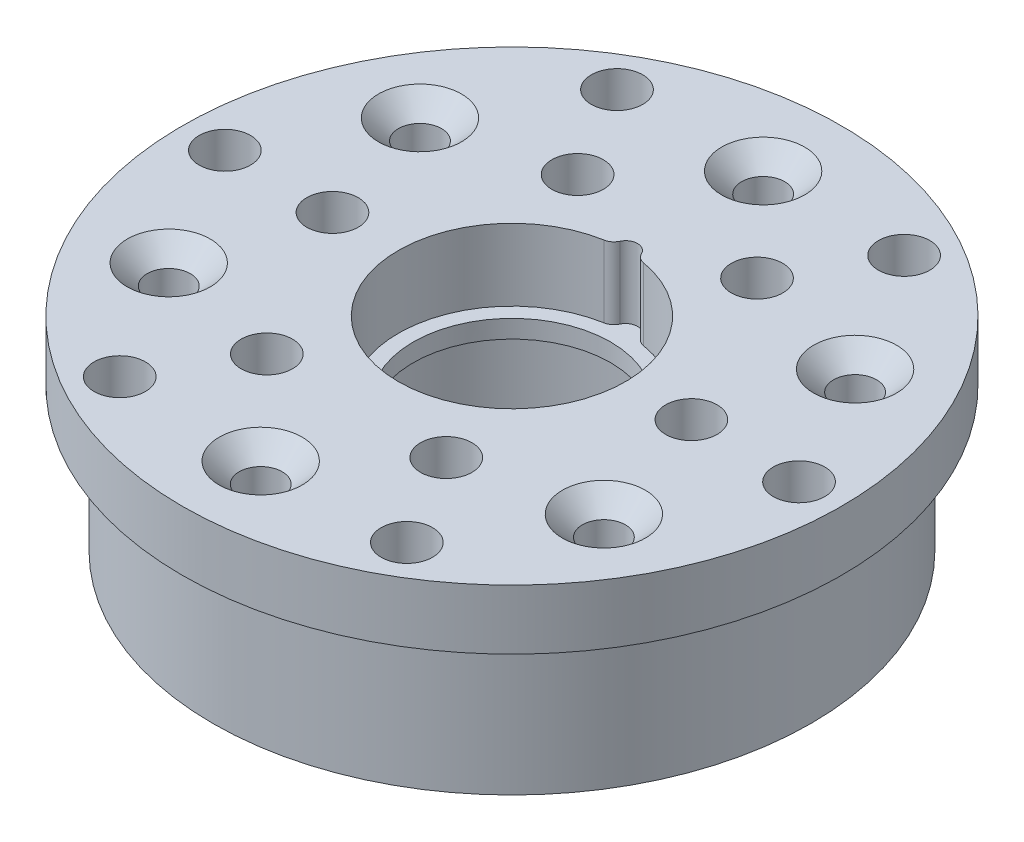
from build123d import *

# Parameters (mm, degrees)
SKETCH1_R                                            = 25
SKETCH1_R_2                                          = 2.5
SKETCH1_R_3                                          = 8.25
BOSS_EXTRUDE1_DEPTH                                  = 10
SKETCH2_R                                            = 15.5
SKETCH2_R_2                                          = 9.5
BOSS_EXTRUDE2_DEPTH                                  = 8.5
SKETCH4_R                                            = 9.5
SKETCH4_R_2                                          = 8.25
BOSS_EXTRUDE3_DEPTH                                  = 2.5
SKETCH3_R                                            = 12.5
CUT_EXTRUDE1_DEPTH                                   = 11
CHAMFER1_SIZE                                        = 3
SKETCH5_R                                            = 25
SKETCH5_R_2                                          = 2.5
SKETCH5_R_3                                          = 15.5
BOSS_EXTRUDE4_DEPTH                                  = 8.5
BOSS_EXTRUDE5_START                                  = -5
SKETCH6_R                                            = 27.55
SKETCH6_R_2                                          = 25
BOSS_EXTRUDE5_DEPTH                                  = 5
SKETCH8_R                                            = 1
CUT_EXTRUDE2_DEPTH                                   = 6
FILLET1_R                                            = 1
SKETCH11_R                                           = 2.15
CUT_EXTRUDE3_DEPTH                                   = 4.8
SKETCH12_R                                           = 25
SKETCH12_R_2                                         = 2.5
SKETCH12_R_3                                         = 12.5
CUT_EXTRUDE4_DEPTH                                   = 1.5
BOSS_EXTRUDE8_START                                  = -4.5
SKETCH14_R                                           = 2.5
SKETCH14_R_2                                         = 1.5
BOSS_EXTRUDE8_DEPTH                                  = 4.5
CSK_FOR_M3_SOCKET_COUNTERSUNK_HEAD_SCREW_D           = 3.6
CSK_FOR_M3_SOCKET_COUNTERSUNK_HEAD_SCREW_CSINK_D     = 6.94
CSK_FOR_M3_SOCKET_COUNTERSUNK_HEAD_SCREW_CSINK_ANGLE = 90


with BuildPart() as part:
    # Sketch1 → Boss-Extrude1 (new body)
    with BuildSketch(Plane(origin=(0, 0, 0), x_dir=(1, 0, 0), z_dir=(0, 1, 0))):
        with Locations(Location((0, 0, 0), (0, 0, 270))):
            Circle(SKETCH1_R)
        with Locations(Location((0, 21, 0), (0, 0, 270))):
            Circle(SKETCH1_R_2, mode=Mode.SUBTRACT)
        with Locations(Location((18.186533479, 10.5, 0), (0, 0, 270))):
            Circle(SKETCH1_R_2, mode=Mode.SUBTRACT)
        with Locations(Location((18.186533479, -10.5, 0), (0, 0, 270))):
            Circle(SKETCH1_R_2, mode=Mode.SUBTRACT)
        with Locations(Location((0, -21, 0), (0, 0, 270))):
            Circle(SKETCH1_R_2, mode=Mode.SUBTRACT)
        with Locations(Location((-18.186533479, -10.5, 0), (0, 0, 270))):
            Circle(SKETCH1_R_2, mode=Mode.SUBTRACT)
        with Locations(Location((-18.186533479, 10.5, 0), (0, 0, 270))):
            Circle(SKETCH1_R_2, mode=Mode.SUBTRACT)
        with Locations(Location((0, 0, 0), (0, 0, 270))):
            Circle(SKETCH1_R_3, mode=Mode.SUBTRACT)
    extrude(amount=BOSS_EXTRUDE1_DEPTH)

    # Sketch2 → Boss-Extrude2 (add)
    with BuildSketch(Plane(origin=(0, 10, 0), x_dir=(1, 0, 0), z_dir=(0, 1, 0))):
        with Locations(Location((0, 0, 0), (0, 0, 270))):
            Circle(SKETCH2_R)
        with Locations(Location((0, 0, 0), (0, 0, 270))):
            Circle(SKETCH2_R_2, mode=Mode.SUBTRACT)
    extrude(amount=BOSS_EXTRUDE2_DEPTH)

    # Sketch4 → Boss-Extrude3 (add)
    with BuildSketch(Plane(origin=(0, 10, 0), x_dir=(1, 0, 0), z_dir=(0, 1, 0))):
        with Locations(Location((0, 0, 0), (0, 0, 270))):
            Circle(SKETCH4_R)
        with Locations(Location((0, 0, 0), (0, 0, 270))):
            Circle(SKETCH4_R_2, mode=Mode.SUBTRACT)
    extrude(amount=BOSS_EXTRUDE3_DEPTH)

    # Sketch3 → Cut-Extrude1 (cut)
    with BuildSketch(Plane.XZ):
        with Locations(Location((0, 0, 0), (0, 0, 270))):
            Circle(SKETCH3_R)
    extrude(amount=-CUT_EXTRUDE1_DEPTH, mode=Mode.SUBTRACT)

    # Chamfer1
    chamfer1_edges = [part.edges().sort_by_distance(p)[0] for p in [
        (0, 11, 12.5),
    ]]
    chamfer(chamfer1_edges, length=CHAMFER1_SIZE)

    # Sketch5 → Boss-Extrude4 (add)
    with BuildSketch(Plane(origin=(0, 10, 0), x_dir=(1, 0, 0), z_dir=(0, 1, 0))):
        with Locations(Location((0, 0, 0), (0, 0, 270))):
            Circle(SKETCH5_R)
        with Locations(Location((0, 21, 0), (0, 0, 270))):
            Circle(SKETCH5_R_2, mode=Mode.SUBTRACT)
        with Locations(Location((18.186533479, 10.5, 0), (0, 0, 270))):
            Circle(SKETCH5_R_2, mode=Mode.SUBTRACT)
        with Locations(Location((18.186533479, -10.5, 0), (0, 0, 270))):
            Circle(SKETCH5_R_2, mode=Mode.SUBTRACT)
        with Locations(Location((0, -21, 0), (0, 0, 270))):
            Circle(SKETCH5_R_2, mode=Mode.SUBTRACT)
        with Locations(Location((-18.186533479, -10.5, 0), (0, 0, 270))):
            Circle(SKETCH5_R_2, mode=Mode.SUBTRACT)
        with Locations(Location((-18.186533479, 10.5, 0), (0, 0, 270))):
            Circle(SKETCH5_R_2, mode=Mode.SUBTRACT)
        Circle(SKETCH5_R_3, mode=Mode.SUBTRACT)
    extrude(amount=BOSS_EXTRUDE4_DEPTH)

    # Sketch6 → Boss-Extrude5 (add)
    with BuildSketch(Plane(origin=(0, 18.5, 0), x_dir=(1, 0, 0), z_dir=(0, 1, 0)).offset(BOSS_EXTRUDE5_START)):
        with Locations(Location((0, 0, 0), (0, 0, 270))):
            Circle(SKETCH6_R)
        with Locations(Location((0, 0, 0), (0, 0, 270))):
            Circle(SKETCH6_R_2, mode=Mode.SUBTRACT)
    extrude(amount=BOSS_EXTRUDE5_DEPTH)

    # Sketch8 → Cut-Extrude2 (cut)
    with BuildSketch(Plane(origin=(0, 18.5, 0), x_dir=(1, 0, 0), z_dir=(0, 1, 0))):
        with Locations((0, 9.5)):
            Circle(SKETCH8_R)
    extrude(amount=-CUT_EXTRUDE2_DEPTH, mode=Mode.SUBTRACT)

    # Fillet1
    fillet1_edges = [part.edges().sort_by_distance(p)[0] for p in [
        (0.998613998, 15.5, -9.447368421),
        (-0.998613998, 15.5, -9.447368421),
    ]]
    fillet(fillet1_edges, radius=FILLET1_R)

    # Sketch11 → Cut-Extrude3 (cut)
    with BuildSketch(Plane(origin=(0, 18.5, 0), x_dir=(1, 0, 0), z_dir=(0, 1, 0))):
        with Locations(Location((7.5, 12.990381057, 0), (0, 0, 270))):
            Circle(SKETCH11_R)
        with Locations(Location((15, 0, 0), (0, 0, 270))):
            Circle(SKETCH11_R)
        with Locations(Location((7.5, -12.990381057, 0), (0, 0, 270))):
            Circle(SKETCH11_R)
        with Locations(Location((-7.5, -12.990381057, 0), (0, 0, 270))):
            Circle(SKETCH11_R)
        with Locations(Location((-15, 0, 0), (0, 0, 270))):
            Circle(SKETCH11_R)
        with Locations(Location((-7.5, 12.990381057, 0), (0, 0, 270))):
            Circle(SKETCH11_R)
        with Locations(Location((-24, 0, 0), (0, 0, 270))):
            Circle(SKETCH11_R)
        with Locations(Location((-12, 20.784609691, 0), (0, 0, 270))):
            Circle(SKETCH11_R)
        with Locations(Location((12, 20.784609691, 0), (0, 0, 270))):
            Circle(SKETCH11_R)
        with Locations(Location((24, 0, 0), (0, 0, 270))):
            Circle(SKETCH11_R)
        with Locations(Location((12, -20.784609691, 0), (0, 0, 270))):
            Circle(SKETCH11_R)
        with Locations(Location((-12, -20.784609691, 0), (0, 0, 270))):
            Circle(SKETCH11_R)
    extrude(amount=-CUT_EXTRUDE3_DEPTH, mode=Mode.SUBTRACT)

    # Sketch12 → Cut-Extrude4 (cut)
    with BuildSketch(Plane.XZ):
        with Locations(Location((0, 0, 0), (0, 0, 270))):
            Circle(SKETCH12_R)
        with Locations(Location((18.186533479, 10.5, 0), (0, 0, 270))):
            Circle(SKETCH12_R_2, mode=Mode.SUBTRACT)
        with Locations(Location((18.186533479, -10.5, 0), (0, 0, 270))):
            Circle(SKETCH12_R_2, mode=Mode.SUBTRACT)
        with Locations(Location((0, -21, 0), (0, 0, 270))):
            Circle(SKETCH12_R_2, mode=Mode.SUBTRACT)
        with Locations(Location((-18.186533479, -10.5, 0), (0, 0, 270))):
            Circle(SKETCH12_R_2, mode=Mode.SUBTRACT)
        with Locations(Location((-18.186533479, 10.5, 0), (0, 0, 270))):
            Circle(SKETCH12_R_2, mode=Mode.SUBTRACT)
        with Locations(Location((0, 21, 0), (0, 0, 270))):
            Circle(SKETCH12_R_2, mode=Mode.SUBTRACT)
        with Locations(Location((0, 0, 0), (0, 0, 270))):
            Circle(SKETCH12_R_3, mode=Mode.SUBTRACT)
    extrude(amount=-CUT_EXTRUDE4_DEPTH, mode=Mode.SUBTRACT)

    # Sketch14 → Boss-Extrude8 (add)
    # profile 1 of 6: a face of its own
    with BuildSketch(Plane(origin=(0, 18.5, 0), x_dir=(1, 0, 0), z_dir=(0, 1, 0)).offset(BOSS_EXTRUDE8_START)):
        with Locations(Location((0, 21, 0), (0, 0, 90))):
            Circle(SKETCH14_R)
        with Locations(Location((0, 21, 0), (0, 0, 270))):
            Circle(SKETCH14_R_2, mode=Mode.SUBTRACT)
    # profile 2 of 6: a face of its own
    with BuildSketch(Plane(origin=(0, 18.5, 0), x_dir=(1, 0, 0), z_dir=(0, 1, 0)).offset(BOSS_EXTRUDE8_START)):
        with Locations(Location((18.186533479, 10.5, 0), (0, 0, 90))):
            Circle(SKETCH14_R)
        with Locations(Location((18.186533479, 10.5, 0), (0, 0, 270))):
            Circle(SKETCH14_R_2, mode=Mode.SUBTRACT)
    # profile 3 of 6: a face of its own
    with BuildSketch(Plane(origin=(0, 18.5, 0), x_dir=(1, 0, 0), z_dir=(0, 1, 0)).offset(BOSS_EXTRUDE8_START)):
        with Locations(Location((18.186533479, -10.5, 0), (0, 0, 90))):
            Circle(SKETCH14_R)
        with Locations(Location((18.186533479, -10.5, 0), (0, 0, 270))):
            Circle(SKETCH14_R_2, mode=Mode.SUBTRACT)
    # profile 4 of 6: a face of its own
    with BuildSketch(Plane(origin=(0, 18.5, 0), x_dir=(1, 0, 0), z_dir=(0, 1, 0)).offset(BOSS_EXTRUDE8_START)):
        with Locations(Location((0, -21, 0), (0, 0, 90))):
            Circle(SKETCH14_R)
        with Locations(Location((0, -21, 0), (0, 0, 270))):
            Circle(SKETCH14_R_2, mode=Mode.SUBTRACT)
    # profile 5 of 6: a face of its own
    with BuildSketch(Plane(origin=(0, 18.5, 0), x_dir=(1, 0, 0), z_dir=(0, 1, 0)).offset(BOSS_EXTRUDE8_START)):
        with Locations(Location((-18.186533479, -10.5, 0), (0, 0, 90))):
            Circle(SKETCH14_R)
        with Locations(Location((-18.186533479, -10.5, 0), (0, 0, 270))):
            Circle(SKETCH14_R_2, mode=Mode.SUBTRACT)
    # profile 6 of 6: a face of its own
    with BuildSketch(Plane(origin=(0, 18.5, 0), x_dir=(1, 0, 0), z_dir=(0, 1, 0)).offset(BOSS_EXTRUDE8_START)):
        with Locations(Location((-18.186533479, 10.5, 0), (0, 0, 90))):
            Circle(SKETCH14_R)
        with Locations(Location((-18.186533479, 10.5, 0), (0, 0, 270))):
            Circle(SKETCH14_R_2, mode=Mode.SUBTRACT)
    extrude(amount=BOSS_EXTRUDE8_DEPTH)

    # CSK for M3 socket countersunk head screw1 (through all)
    with Locations(Plane(origin=(0, 18.5, 0), x_dir=(1, 0, 0), z_dir=(0, 1, 0))):
        with Locations((0, 21), (18.186533479, 10.5), (18.186533479, -10.5), (0, -21), (-18.186533479, -10.5), (-18.186533479, 10.5)):
            CounterSinkHole(CSK_FOR_M3_SOCKET_COUNTERSUNK_HEAD_SCREW_D / 2, CSK_FOR_M3_SOCKET_COUNTERSUNK_HEAD_SCREW_CSINK_D / 2, counter_sink_angle=CSK_FOR_M3_SOCKET_COUNTERSUNK_HEAD_SCREW_CSINK_ANGLE)


solid = part.part
